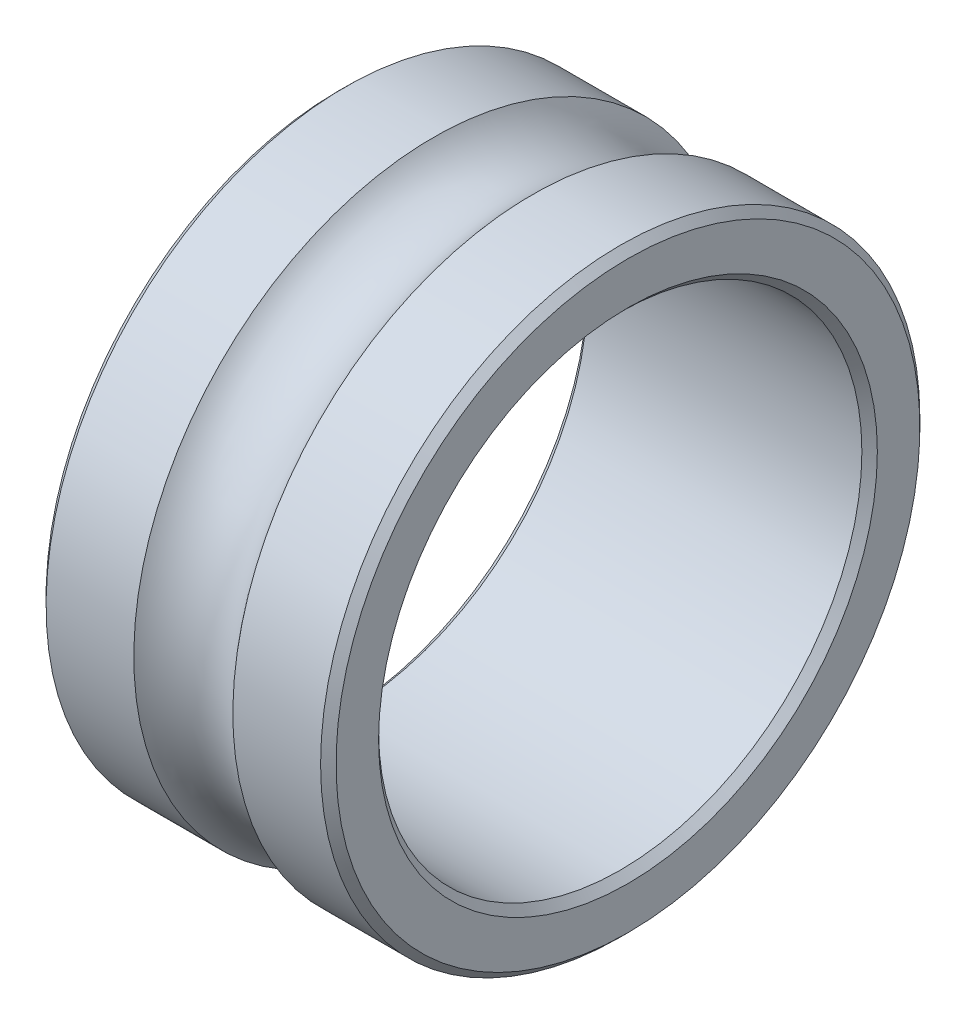
from build123d import *

# Parameters (mm, degrees)
CHAMFER2_SIZE = 0.08


with BuildPart() as part:
    # Sketch1 → Revolve1 (revolve)
    with BuildSketch(Plane.XY):
        with BuildLine():
            Line((0.512347538, -3.1), (1.5, -3.1))
            Line((1.5, -3.1), (1.5, -2.5))
            Line((1.5, -2.5), (-1.5, -2.5))
            Line((-1.5, -2.5), (-1.5, -3.1))
            Line((-1.5, -3.1), (-0.512347538, -3.1))
            ThreePointArc((-0.512347538, -3.1), (0, -2.85), (0.512347538, -3.1))
        make_face()
    revolve(axis=Axis((-6.429017492, 0, 0), (1, 0, 0)))

    # Chamfer2
    chamfer2_edges = [part.edges().sort_by_distance(p)[0] for p in [
        (1.5, 3.1, 0),
        (1.5, 2.5, 0),
        (-1.5, 2.5, 0),
        (-1.5, 3.1, 0),
    ]]
    chamfer(chamfer2_edges, length=CHAMFER2_SIZE)


solid = part.part
